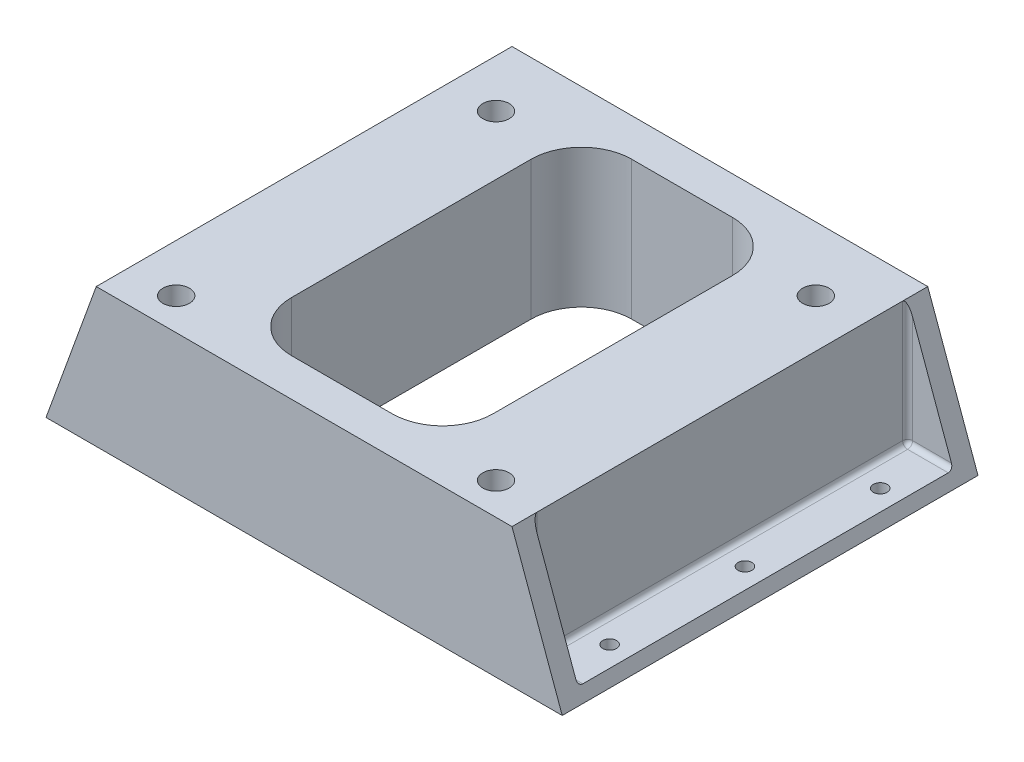
from build123d import *

# Parameters (mm, degrees)
SKETCH1_W           = 205
SKETCH1_H           = 165.1
BOSS_EXTRUDE1_DEPTH = 55
CUT_EXTRUDE1_REACH  = 203.964
SKETCH3_W           = 19.95
SKETCH3_H           = 149.1
CUT_EXTRUDE2_DEPTH  = 50
CUT_EXTRUDE3_REACH  = 142.786
SKETCH4_R           = 2.75
FILLET1_R           = 2
SKETCH5_R           = 5.25
CUT_EXTRUDE4_DEPTH  = 10
CUT_EXTRUDE5_REACH  = 144.639
SKETCH6_W           = 80
SKETCH6_H           = 135.1
FILLET2_R           = 20


with BuildPart() as part:
    # Sketch1 → Boss-Extrude1 (new body)
    with BuildSketch(Plane(origin=(0, 0, 0), x_dir=(1, 0, 0), z_dir=(0, 1, 0))):
        Rectangle(SKETCH1_W, SKETCH1_H)
    extrude(amount=BOSS_EXTRUDE1_DEPTH)

    # Sketch2 → Cut-Extrude1 (cut, up to next)
    with BuildSketch(Plane.XY.offset(82.55), mode=Mode.PRIVATE) as cut_extrude1_sk1:
        Polygon((82.55, 55), (102.5, 0), (102.5, 55), align=None)
    cut_extrude1_tool1 = extrude(cut_extrude1_sk1.sketch, amount=-CUT_EXTRUDE1_REACH, mode=Mode.PRIVATE) & part.part
    # Sketch2 → Cut-Extrude1 (cut, up to next)
    with BuildSketch(Plane.XY.offset(82.55), mode=Mode.PRIVATE) as cut_extrude1_sk2:
        Polygon((-82.55, 55), (-102.5, 0), (-102.5, 55), align=None)
    cut_extrude1_tool2 = extrude(cut_extrude1_sk2.sketch, amount=-CUT_EXTRUDE1_REACH, mode=Mode.PRIVATE) & part.part
    add(cut_extrude1_tool1.solids().sort_by_distance((95.85, 36.666667, 82.55))[0], mode=Mode.SUBTRACT)
    add(cut_extrude1_tool2.solids().sort_by_distance((-95.85, 36.666667, 82.55))[0], mode=Mode.SUBTRACT)

    # Sketch3 → Cut-Extrude2 (cut)
    with BuildSketch(Plane(origin=(0, 55, 0), x_dir=(1, 0, 0), z_dir=(0, 1, 0))):
        with Locations((-92.525, 0)):
            Rectangle(SKETCH3_W, SKETCH3_H)
        with Locations((92.525, 0)):
            Rectangle(SKETCH3_W, SKETCH3_H)
    extrude(amount=-CUT_EXTRUDE2_DEPTH, mode=Mode.SUBTRACT)

    # Sketch4 → Cut-Extrude3 (cut, up to next)
    with BuildSketch(Plane(origin=(0, 5, 0), x_dir=(1, 0, 0), z_dir=(0, 1, 0)), mode=Mode.PRIVATE) as cut_extrude3_sk1:
        with Locations(Location((-92.5, 53.71150957, 0), (0, 0, 270))):
            Circle(SKETCH4_R)
    cut_extrude3_tool1 = extrude(cut_extrude3_sk1.sketch, amount=-CUT_EXTRUDE3_REACH, mode=Mode.PRIVATE) & part.part
    # Sketch4 → Cut-Extrude3 (cut, up to next)
    with BuildSketch(Plane(origin=(0, 5, 0), x_dir=(1, 0, 0), z_dir=(0, 1, 0)), mode=Mode.PRIVATE) as cut_extrude3_sk2:
        with Locations(Location((-92.5, 0, 0), (0, 0, 270))):
            Circle(SKETCH4_R)
    cut_extrude3_tool2 = extrude(cut_extrude3_sk2.sketch, amount=-CUT_EXTRUDE3_REACH, mode=Mode.PRIVATE) & part.part
    # Sketch4 → Cut-Extrude3 (cut, up to next)
    with BuildSketch(Plane(origin=(0, 5, 0), x_dir=(1, 0, 0), z_dir=(0, 1, 0)), mode=Mode.PRIVATE) as cut_extrude3_sk3:
        with Locations(Location((-92.5, -53.71150957, 0), (0, 0, 90))):
            Circle(SKETCH4_R)
    cut_extrude3_tool3 = extrude(cut_extrude3_sk3.sketch, amount=-CUT_EXTRUDE3_REACH, mode=Mode.PRIVATE) & part.part
    # Sketch4 → Cut-Extrude3 (cut, up to next)
    with BuildSketch(Plane(origin=(0, 5, 0), x_dir=(1, 0, 0), z_dir=(0, 1, 0)), mode=Mode.PRIVATE) as cut_extrude3_sk4:
        with Locations(Location((92.5, -53.71150957, 0), (0, 0, 270))):
            Circle(SKETCH4_R)
    cut_extrude3_tool4 = extrude(cut_extrude3_sk4.sketch, amount=-CUT_EXTRUDE3_REACH, mode=Mode.PRIVATE) & part.part
    # Sketch4 → Cut-Extrude3 (cut, up to next)
    with BuildSketch(Plane(origin=(0, 5, 0), x_dir=(1, 0, 0), z_dir=(0, 1, 0)), mode=Mode.PRIVATE) as cut_extrude3_sk5:
        with Locations(Location((92.5, 0, 0), (0, 0, 90))):
            Circle(SKETCH4_R)
    cut_extrude3_tool5 = extrude(cut_extrude3_sk5.sketch, amount=-CUT_EXTRUDE3_REACH, mode=Mode.PRIVATE) & part.part
    # Sketch4 → Cut-Extrude3 (cut, up to next)
    with BuildSketch(Plane(origin=(0, 5, 0), x_dir=(1, 0, 0), z_dir=(0, 1, 0)), mode=Mode.PRIVATE) as cut_extrude3_sk6:
        with Locations(Location((92.5, 53.71150957, 0), (0, 0, 90))):
            Circle(SKETCH4_R)
    cut_extrude3_tool6 = extrude(cut_extrude3_sk6.sketch, amount=-CUT_EXTRUDE3_REACH, mode=Mode.PRIVATE) & part.part
    add(cut_extrude3_tool1.solids().sort_by_distance((-92.5, 5, -53.71151))[0], mode=Mode.SUBTRACT)
    add(cut_extrude3_tool2.solids().sort_by_distance((-92.5, 5, 0))[0], mode=Mode.SUBTRACT)
    add(cut_extrude3_tool3.solids().sort_by_distance((-92.5, 5, 53.71151))[0], mode=Mode.SUBTRACT)
    add(cut_extrude3_tool4.solids().sort_by_distance((92.5, 5, 53.71151))[0], mode=Mode.SUBTRACT)
    add(cut_extrude3_tool5.solids().sort_by_distance((92.5, 5, 0))[0], mode=Mode.SUBTRACT)
    add(cut_extrude3_tool6.solids().sort_by_distance((92.5, 5, -53.71151))[0], mode=Mode.SUBTRACT)

    # Fillet1
    fillet1_edges = [part.edges().sort_by_distance(p)[0] for p in [
        (-91.618181818, 5, -74.55),
        (-82.55, 30, 74.55),
        (-91.618181818, 5, 74.55),
        (-82.55, 5, 0),
        (-82.55, 30, -74.55),
        (91.618181818, 5, 74.55),
        (82.55, 30, -74.55),
        (91.618181818, 5, -74.55),
        (82.55, 5, 0),
        (82.55, 30, 74.55),
    ]]
    fillet(fillet1_edges, radius=FILLET1_R)

    # Sketch5 → Cut-Extrude4 (cut)
    with BuildSketch(Plane(origin=(0, 55, 0), x_dir=(1, 0, 0), z_dir=(0, 1, 0))):
        with Locations(Location((63.5, -69.85, 0), (0, 0, 270))):
            Circle(SKETCH5_R)
        with Locations(Location((63.5, 57.15, 0), (0, 0, 270))):
            Circle(SKETCH5_R)
    cut_extrude4 = extrude(amount=-CUT_EXTRUDE4_DEPTH, mode=Mode.SUBTRACT)

    # Mirror1: Cut-Extrude4 across plane
    add(cut_extrude4.mirror(Plane(origin=(0, 0, 0), x_dir=(0, 0, 1), z_dir=(1, 0, 0))), mode=Mode.SUBTRACT)

    # Sketch6 → Cut-Extrude5 (cut, up to next)
    with BuildSketch(Plane(origin=(0, 55, 0), x_dir=(1, 0, 0), z_dir=(0, 1, 0)), mode=Mode.PRIVATE) as cut_extrude5_sk1:
        Rectangle(SKETCH6_W, SKETCH6_H)
    cut_extrude5_tool1 = extrude(cut_extrude5_sk1.sketch, amount=-CUT_EXTRUDE5_REACH, mode=Mode.PRIVATE) & part.part
    add(cut_extrude5_tool1.solids().sort_by_distance((0, 55, 0))[0], mode=Mode.SUBTRACT)

    # Fillet2
    fillet2_edges = [part.edges().sort_by_distance(p)[0] for p in [
        (40, 27.5, -67.55),
        (40, 27.5, 67.55),
        (-40, 27.5, 67.55),
        (-40, 27.5, -67.55),
    ]]
    fillet(fillet2_edges, radius=FILLET2_R)


solid = part.part
